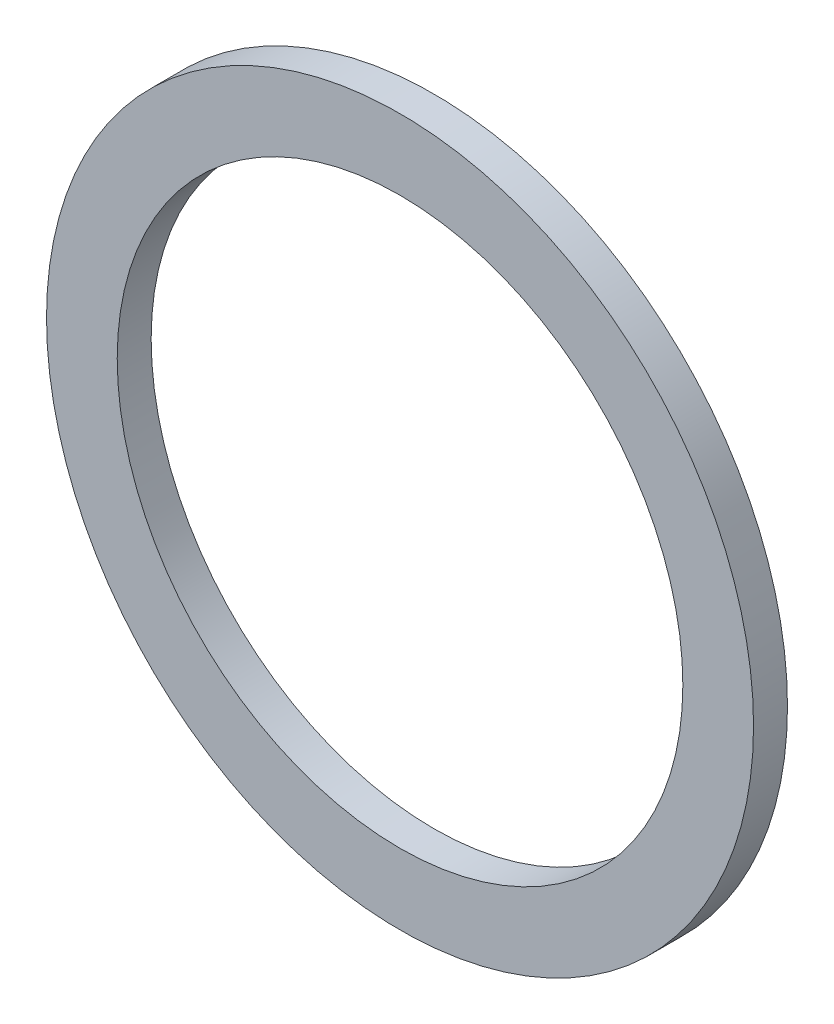
from build123d import *

# Parameters (mm, degrees)
SKETCH_1_R      = 12.5
SKETCH_1_R_2    = 10
EXTRUDE_1_DEPTH = 1.2


with BuildPart() as part:
    # Эскиз1 → Вытянуть1 (new body)
    with BuildSketch(Plane.XY):
        Circle(SKETCH_1_R)
        Circle(SKETCH_1_R_2, mode=Mode.SUBTRACT)
    extrude(amount=EXTRUDE_1_DEPTH)


solid = part.part
